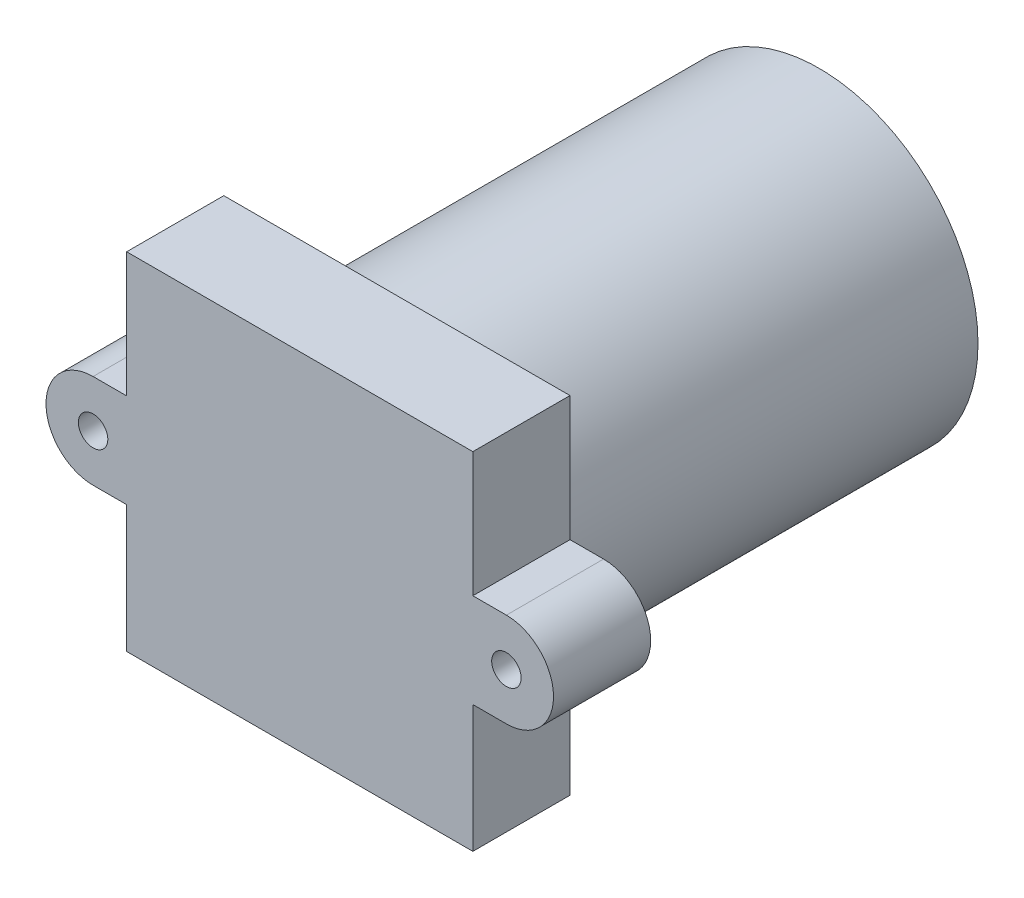
from build123d import *

# Parameters (mm, degrees)
SKETCH1_R           = 6.858
BOSS_EXTRUDE1_DEPTH = 18.2118
SKETCH2_R           = 0.635
BOSS_EXTRUDE2_DEPTH = 4.191


with BuildPart() as part:
    # Sketch1 → Boss-Extrude1 (new body)
    with BuildSketch(Plane.XY):
        Circle(SKETCH1_R)
    extrude(amount=BOSS_EXTRUDE1_DEPTH)

    # Sketch2 → Boss-Extrude2 (add)
    with BuildSketch(Plane.XY.offset(18.2118)):
        with BuildLine():
            Line((-7.4676, 7.4676), (7.4676, 7.4676))
            Line((7.4676, 7.4676), (7.4676, 2.0828))
            Line((7.4676, 2.0828), (8.9154, 2.0828))
            ThreePointArc((8.9154, 2.0828), (10.9474, 0.0508), (8.9154, -1.9812))
            Line((8.9154, -1.9812), (7.4676, -1.9812))
            Line((7.4676, -1.9812), (7.4676, -7.4676))
            Line((7.4676, -7.4676), (-7.4676, -7.4676))
            Line((-7.4676, -7.4676), (-7.4676, -1.9812))
            Line((-7.4676, -1.9812), (-8.9154, -1.9812))
            ThreePointArc((-8.9154, -1.9812), (-10.9474, 0.0508), (-8.9154, 2.0828))
            Line((-8.9154, 2.0828), (-7.4676, 2.0828))
            Line((-7.4676, 2.0828), (-7.4676, 7.4676))
        make_face()
        with Locations((-8.9154, 0.0508)):
            Circle(SKETCH2_R, mode=Mode.SUBTRACT)
        with Locations((8.9154, 0.0508)):
            Circle(SKETCH2_R, mode=Mode.SUBTRACT)
    extrude(amount=BOSS_EXTRUDE2_DEPTH)


solid = part.part
